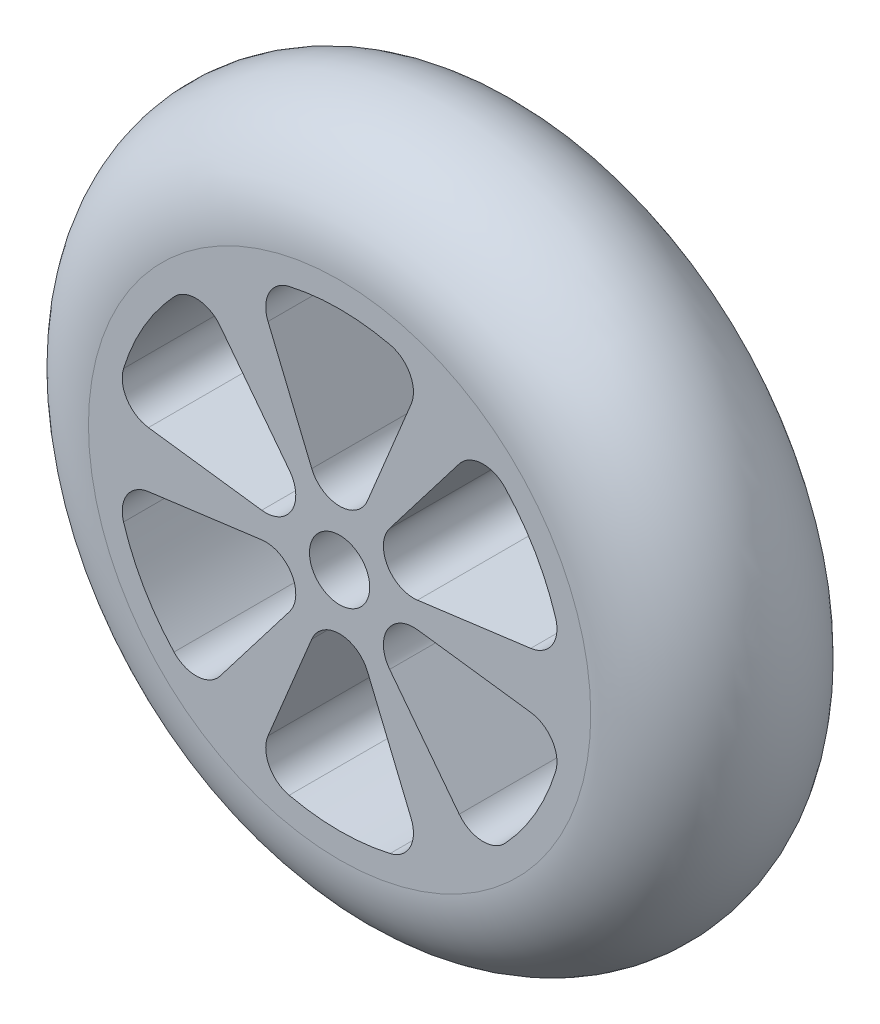
from build123d import *

# Parameters (mm, degrees)
SKETCH2_R           = 50
SKETCH2_R_2         = 6
BOSS_EXTRUDE1_DEPTH = 40
CUT_EXTRUDE1_DEPTH  = 82.240384046
CIRPATTERN1_COUNT   = 6


with BuildPart() as part:
    # Sketch2 → Boss-Extrude1 (new body)
    with BuildSketch(Plane.XY):
        Circle(SKETCH2_R)
        Circle(SKETCH2_R_2, mode=Mode.SUBTRACT)
    extrude(amount=BOSS_EXTRUDE1_DEPTH)

    # Sketch1 → Cut-Extrude1 (cut, through all)
    with BuildSketch(Plane.XY.offset(40)):
        with BuildLine():
            Line((-5.543277195, -14.703899406), (-14.248413133, -35.719956649))
            ThreePointArc((-14.248413133, -35.719956649), (-14.036780749, -40.768068072), (-10.04438762, -43.864681434))
            ThreePointArc((-10.04438762, -43.864681434), (0, -45), (10.04438762, -43.864681434))
            ThreePointArc((10.04438762, -43.864681434), (14.036780749, -40.768068072), (14.248413133, -35.719956649))
            Line((14.248413133, -35.719956649), (5.543277195, -14.703899406))
            ThreePointArc((5.543277195, -14.703899406), (0, -11), (-5.543277195, -14.703899406))
        make_face()
    cut_extrude1 = extrude(amount=-CUT_EXTRUDE1_DEPTH, mode=Mode.SUBTRACT)

    # CirPattern1: Cut-Extrude1 ×6 about axis
    cirpattern1_axis = Axis((0, 0, 0), (0, 0, 1))
    for i in range(1, CIRPATTERN1_COUNT):
        add(cut_extrude1.rotate(cirpattern1_axis, i * 360 / CIRPATTERN1_COUNT), mode=Mode.SUBTRACT)

    # Sketch3 → Revolve1 (revolve)
    with BuildSketch(Plane(origin=(0, 0, 0), x_dir=(1, 0, 0), z_dir=(0, 1, 0))):
        with BuildLine():
            Line((50, 0), (50, -40))
            ThreePointArc((50, -40), (70, -20), (50, 0))
        make_face()
    revolve(axis=Axis((0, 0, 40), (0, 0, -1)))


solid = part.part
